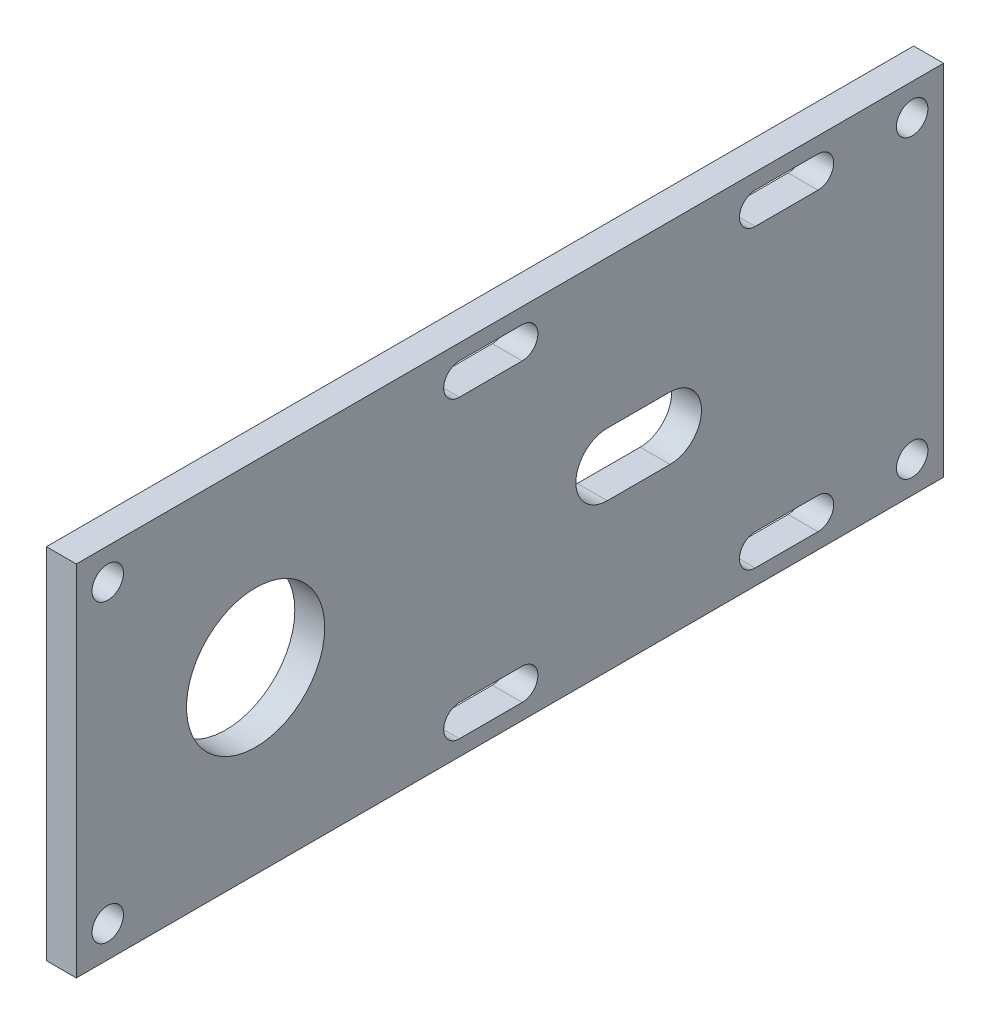
from build123d import *

# Parameters (mm, degrees)
SKETCH1_W           = 138.1
SKETCH1_H           = 57.1
SKETCH1_R           = 2.5
SKETCH1_R_2         = 11
BOSS_EXTRUDE1_DEPTH = 4.7625


with BuildPart() as part:
    # Sketch1 → Boss-Extrude1 (new body)
    with BuildSketch(Plane.ZY):
        with Locations((-69.05, -28.55)):
            Rectangle(SKETCH1_W, SKETCH1_H)
        with Locations(Location((-133.1, -5, 0), (0, 0, 180))):
            Circle(SKETCH1_R, mode=Mode.SUBTRACT)
        with Locations(Location((-133.1, -52.1, 0), (0, 0, 180))):
            Circle(SKETCH1_R, mode=Mode.SUBTRACT)
        with Locations(Location((-28.55, -28.55, 0), (0, 0, 180))):
            Circle(SKETCH1_R_2, mode=Mode.SUBTRACT)
        with Locations(Location((-5, -5, 0), (0, 0, 180))):
            Circle(SKETCH1_R, mode=Mode.SUBTRACT)
        with Locations(Location((-5, -52.1, 0), (0, 0, 180))):
            Circle(SKETCH1_R, mode=Mode.SUBTRACT)
        with BuildLine():
            Line((-108.1, -7.5), (-118.1, -7.5))
            ThreePointArc((-118.1, -7.5), (-120.6, -5), (-118.1, -2.5))
            Line((-118.1, -2.5), (-108.1, -2.5))
            ThreePointArc((-108.1, -2.5), (-105.6, -5), (-108.1, -7.5))
        make_face(mode=Mode.SUBTRACT)
        with BuildLine():
            Line((-108.1, -54.6), (-118.1, -54.6))
            ThreePointArc((-118.1, -54.6), (-120.6, -52.1), (-118.1, -49.6))
            Line((-118.1, -49.6), (-108.1, -49.6))
            ThreePointArc((-108.1, -49.6), (-105.6, -52.1), (-108.1, -54.6))
        make_face(mode=Mode.SUBTRACT)
        with BuildLine():
            Line((-61, -7.5), (-71, -7.5))
            ThreePointArc((-71, -7.5), (-73.5, -5), (-71, -2.5))
            Line((-71, -2.5), (-61, -2.5))
            ThreePointArc((-61, -2.5), (-58.5, -5), (-61, -7.5))
        make_face(mode=Mode.SUBTRACT)
        with BuildLine():
            Line((-61, -54.6), (-71, -54.6))
            ThreePointArc((-71, -54.6), (-73.5, -52.1), (-71, -49.6))
            Line((-71, -49.6), (-61, -49.6))
            ThreePointArc((-61, -49.6), (-58.5, -52.1), (-61, -54.6))
        make_face(mode=Mode.SUBTRACT)
        with BuildLine():
            Line((-84.55, -33.55), (-94.55, -33.55))
            ThreePointArc((-94.55, -33.55), (-99.55, -28.55), (-94.55, -23.55))
            Line((-94.55, -23.55), (-84.55, -23.55))
            ThreePointArc((-84.55, -23.55), (-79.55, -28.55), (-84.55, -33.55))
        make_face(mode=Mode.SUBTRACT)
    extrude(amount=BOSS_EXTRUDE1_DEPTH)


solid = part.part
